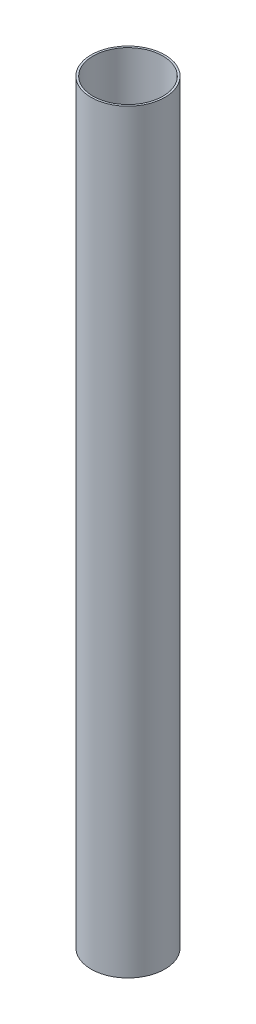
from build123d import *

# Parameters (mm, degrees)
SKETCH1_R           = 25.4
SKETCH1_R_2         = 24.0538
EXTRUDE_THIN1_DEPTH = 520.192


with BuildPart() as part:
    # Sketch1 → Extrude-Thin1 (new body)
    with BuildSketch(Plane(origin=(0, 0, 0), x_dir=(1, 0, 0), z_dir=(0, 1, 0))):
        Circle(SKETCH1_R)
        Circle(SKETCH1_R_2, mode=Mode.SUBTRACT)
    extrude(amount=EXTRUDE_THIN1_DEPTH)


solid = part.part
